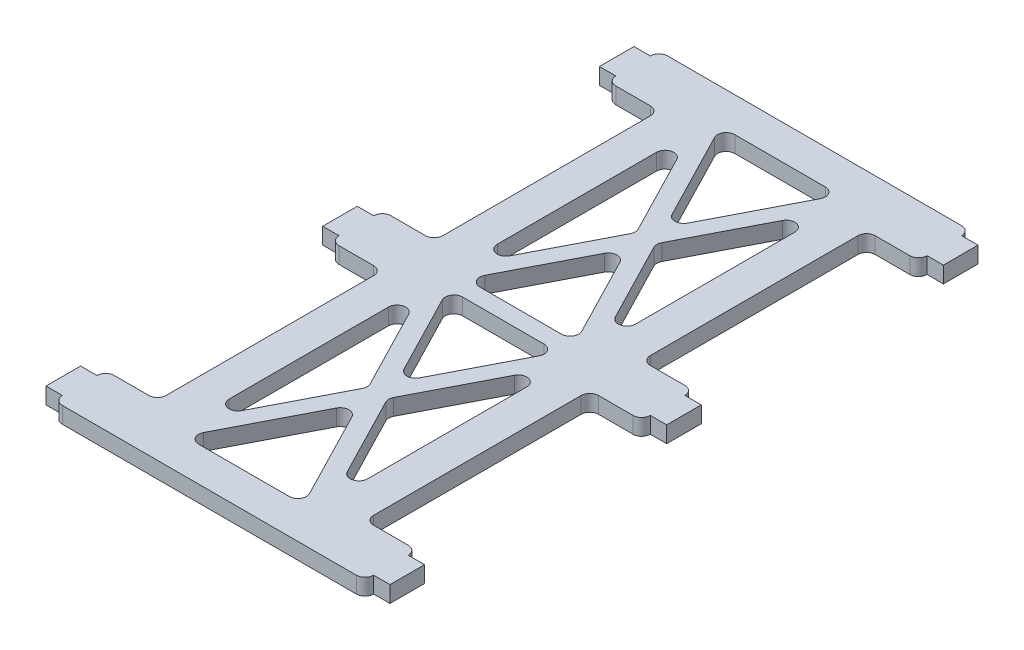
from build123d import *

# Parameters (mm, degrees)
SKETCH1_W           = 38.1
SKETCH1_H           = 111.125
BOSS_EXTRUDE1_DEPTH = 1.5
SKETCH2_W           = 9.525
SKETCH2_H           = 9.525
BOSS_EXTRUDE2_DEPTH = 3
CUT_EXTRUDE1_DEPTH  = 3
FILLET1_R           = 1.5875
SKETCH5_W           = 3
SKETCH5_H           = 6.35
BOSS_EXTRUDE3_DEPTH = 3


with BuildPart() as part:
    # Sketch1 → Boss-Extrude1 (new, symmetric)
    with BuildSketch(Plane(origin=(0, 34.29, 0), x_dir=(1, 0, 0), z_dir=(0, 1, 0))):
        with Locations((0, 120.65)):
            Rectangle(SKETCH1_W, SKETCH1_H)
    extrude(amount=BOSS_EXTRUDE1_DEPTH, both=True)

    # Sketch2 → Boss-Extrude2 (add)
    with BuildSketch(Plane(origin=(0, 35.79, 0), x_dir=(1, 0, 0), z_dir=(0, 1, 0))):
        with Locations((23.8125, 171.45)):
            Rectangle(SKETCH2_W, SKETCH2_H)
        with Locations((-23.8125, 171.45)):
            Rectangle(SKETCH2_W, SKETCH2_H)
        with Locations((23.8125, 120.65)):
            Rectangle(SKETCH2_W, SKETCH2_H)
        with Locations((-23.8125, 120.65)):
            Rectangle(SKETCH2_W, SKETCH2_H)
        with Locations((23.8125, 69.85)):
            Rectangle(SKETCH2_W, SKETCH2_H)
        with Locations((-23.8125, 69.85)):
            Rectangle(SKETCH2_W, SKETCH2_H)
    extrude(amount=-BOSS_EXTRUDE2_DEPTH)

    # Sketch4 → Cut-Extrude1 (cut)
    with BuildSketch(Plane(origin=(0, 35.79, 0), x_dir=(1, 0, 0), z_dir=(0, 1, 0))):
        Polygon((10.913523411, 169.8625), (-10.913523411, 169.8625), (0, 148.71754839), align=None)
        Polygon((-1.786476589, 145.25625), (-12.7, 166.40120161), (-12.7, 124.11129839), align=None)
        Polygon((12.7, 166.40120161), (1.786476589, 145.25625), (12.7, 124.11129839), align=None)
        Polygon((10.094168573, 122.2375), (0, 141.79495161), (-10.094168573, 122.2375), align=None)
        Polygon((-1.786476589, 96.04375), (-12.7, 117.18870161), (-12.7, 74.89879839), align=None)
        Polygon((10.094168573, 119.0625), (-10.094168573, 119.0625), (0, 99.50504839), align=None)
        Polygon((12.7, 74.89879839), (12.7, 117.18870161), (1.786476589, 96.04375), align=None)
        Polygon((10.913523411, 71.4375), (0, 92.58245161), (-10.913523411, 71.4375), align=None)
    extrude(amount=-CUT_EXTRUDE1_DEPTH, mode=Mode.SUBTRACT)

    # Fillet1
    fillet1_edges = [part.edges().sort_by_distance(p)[0] for p in [
        (10.094168573, 34.29, -122.2375),
        (-10.094168573, 34.29, -122.2375),
        (0, 34.29, -141.79495161),
        (10.094168573, 34.29, -119.0625),
        (0, 34.29, -99.50504839),
        (-10.094168573, 34.29, -119.0625),
        (10.913523411, 34.29, -71.4375),
        (-10.913523411, 34.29, -71.4375),
        (0, 34.29, -92.58245161),
        (-1.786476589, 34.29, -96.04375),
        (-12.7, 34.29, -74.89879839),
        (-12.7, 34.29, -117.18870161),
        (-1.786476589, 34.29, -145.25625),
        (-12.7, 34.29, -124.11129839),
        (-12.7, 34.29, -166.40120161),
        (12.7, 34.29, -124.11129839),
        (1.786476589, 34.29, -145.25625),
        (12.7, 34.29, -166.40120161),
        (0, 34.29, -148.71754839),
        (-10.913523411, 34.29, -169.8625),
        (10.913523411, 34.29, -169.8625),
        (12.7, 34.29, -117.18870161),
        (12.7, 34.29, -74.89879839),
        (1.786476589, 34.29, -96.04375),
        (28.575, 34.29, -65.0875),
        (28.575, 34.29, -74.6125),
        (19.05, 34.29, -74.6125),
        (-19.05, 34.29, -115.8875),
        (-19.05, 34.29, -125.4125),
        (-28.575, 34.29, -125.4125),
        (-28.575, 34.29, -115.8875),
        (28.575, 34.29, -115.8875),
        (28.575, 34.29, -125.4125),
        (19.05, 34.29, -125.4125),
        (19.05, 34.29, -115.8875),
        (-19.05, 34.29, -166.6875),
        (-28.575, 34.29, -176.2125),
        (-28.575, 34.29, -166.6875),
        (-19.05, 34.29, -74.6125),
        (-28.575, 34.29, -74.6125),
        (-28.575, 34.29, -65.0875),
        (28.575, 34.29, -166.6875),
        (28.575, 34.29, -176.2125),
        (19.05, 34.29, -166.6875),
    ]]
    fillet(fillet1_edges, radius=FILLET1_R)

    # Sketch5 → Boss-Extrude3 (add)
    with BuildSketch(Plane(origin=(0, 35.79, 0), x_dir=(1, 0, 0), z_dir=(0, 1, 0))):
        with Locations((30.075, 171.45)):
            Rectangle(SKETCH5_W, SKETCH5_H)
        with Locations((-30.075, 171.45)):
            Rectangle(SKETCH5_W, SKETCH5_H)
        with Locations((30.075, 120.65)):
            Rectangle(SKETCH5_W, SKETCH5_H)
        with Locations((-30.075, 120.65)):
            Rectangle(SKETCH5_W, SKETCH5_H)
        with Locations((30.075, 69.85)):
            Rectangle(SKETCH5_W, SKETCH5_H)
        with Locations((-30.075, 69.85)):
            Rectangle(SKETCH5_W, SKETCH5_H)
    extrude(amount=-BOSS_EXTRUDE3_DEPTH)


solid = part.part
